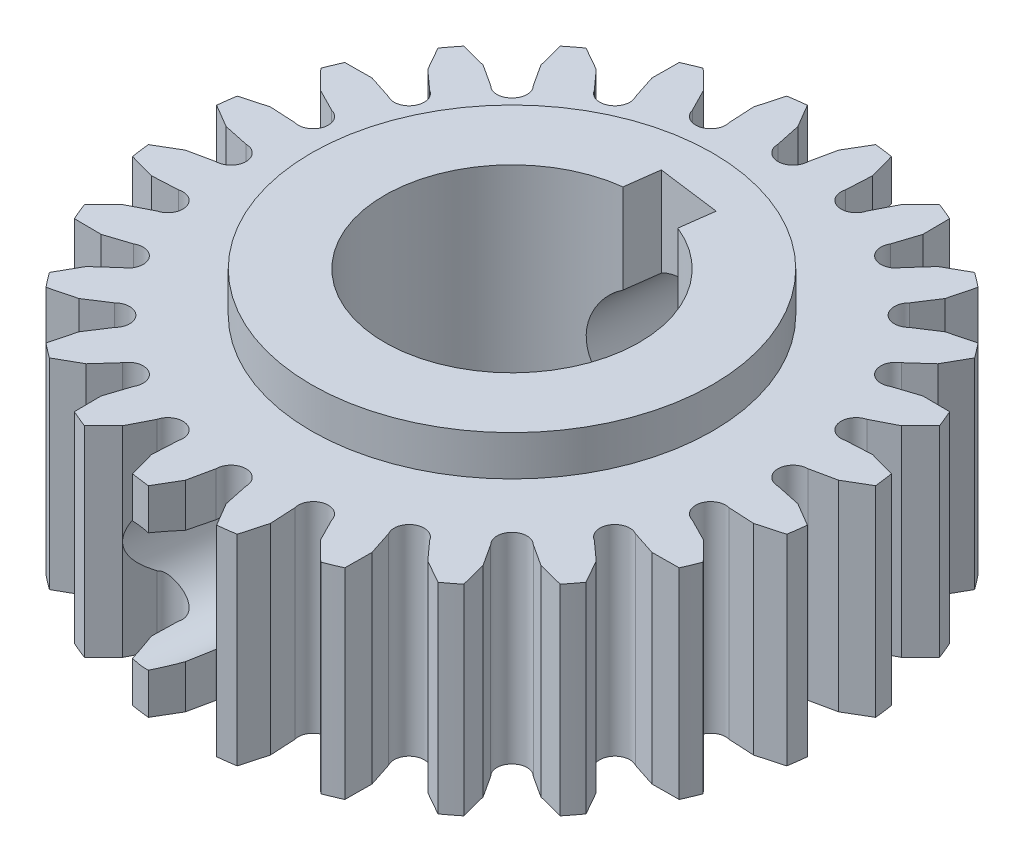
from build123d import *

# Parameters (mm, degrees)
BOSS_EXTRUDE2_DEPTH     = 5
CUT_EXTRUDE2_DEPTH      = 13.700001969
CIRPATTERN1_COUNT       = 24
SKETCH4_R               = 5
BOSS_EXTRUDE3_DEPTH     = 1
SKETCH5_R               = 3.175
CUT_EXTRUDE3_DEPTH      = 14.070770827
CUT_EXTRUDE4_DEPTH      = 14.070770827
CUT_EXTRUDE4_DEPTH_BACK = 14.070770827


with BuildPart() as part:
    # Sketch2 → Boss-Extrude2 (new body)
    with BuildSketch(Plane(origin=(0, 0, 0), x_dir=(1, 0, 0), z_dir=(0, 1, 0))):
        with BuildLine():
            ThreePointArc((-0.975804038, 8.197123366), (-5.48132113, -6.172531382), (8.255, 0))
            ThreePointArc((8.255, 0), (6.172531382, 5.48132113), (0.975804038, 8.197123366))
            add(Edge.make_bspline(
                [(0.375, 7.0025), (0.502106264, 7.67368826), (0.975804038, 8.197123366)],
                knots=[0, 0, 0, 1, 1, 1], degree=2))
            ThreePointArc((0.375, 7.0025), (0, 6.6275), (-0.375, 7.0025))
            add(Edge.make_bspline(
                [(-0.375, 7.0025), (-0.502106264, 7.67368826), (-0.975804038, 8.197123366)],
                knots=[0, 0, 0, 1, 1, 1], degree=2))
        make_face()
        with BuildLine():
            add(Edge.make_bspline(
                [(0.375, 7.0025), (0.502106264, 7.67368826), (0.975804038, 8.197123366)],
                knots=[0, 0, 0, 1, 1, 1], degree=2))
            ThreePointArc((0.975804038, 8.197123366), (0, 8.255), (-0.975804038, 8.197123366))
            add(Edge.make_bspline(
                [(-0.375, 7.0025), (-0.502106264, 7.67368826), (-0.975804038, 8.197123366)],
                knots=[0, 0, 0, 1, 1, 1], degree=2))
            ThreePointArc((-0.375, 7.0025), (0, 6.6275), (0.375, 7.0025))
        make_face()
    extrude(amount=BOSS_EXTRUDE2_DEPTH)

    # Sketch3 → Cut-Extrude2 (cut, through all)
    with BuildSketch(Plane(origin=(0, 5, 0), x_dir=(1, 0, 0), z_dir=(0, 1, 0))):
        with BuildLine():
            Line((-0.375, 7.0025), (-0.508801653, 7.631638432))
            Line((-0.508801653, 7.631638432), (-0.85, 8.211122031))
            ThreePointArc((-0.85, 8.211122031), (0, 8.255), (0.85, 8.211122031))
            Line((0.85, 8.211122031), (0.508801653, 7.631638432))
            Line((0.508801653, 7.631638432), (0.375, 7.0025))
            ThreePointArc((0.375, 7.0025), (0, 6.6275), (-0.375, 7.0025))
        make_face()
    cut_extrude2 = extrude(amount=-CUT_EXTRUDE2_DEPTH, mode=Mode.SUBTRACT)

    # CirPattern1: Cut-Extrude2 ×24 about axis
    cirpattern1_axis = Axis((0, 0, 0), (0, 1, 0))
    for i in range(1, CIRPATTERN1_COUNT):
        add(cut_extrude2.rotate(cirpattern1_axis, i * 360 / CIRPATTERN1_COUNT), mode=Mode.SUBTRACT)

    # Sketch4 → Boss-Extrude3 (add)
    with BuildSketch(Plane(origin=(0, 5, 0), x_dir=(1, 0, 0), z_dir=(0, 1, 0))):
        with Locations(Location((0, 0, 0), (0, 0, 270))):
            Circle(SKETCH4_R)
    extrude(amount=BOSS_EXTRUDE3_DEPTH)

    # Sketch5 → Cut-Extrude3 (cut, through all)
    with BuildSketch(Plane(origin=(0, 6, 0), x_dir=(1, 0, 0), z_dir=(0, 1, 0))):
        with Locations(Location((0, 0, 0), (0, 0, 270))):
            Circle(SKETCH5_R)
    extrude(amount=-CUT_EXTRUDE3_DEPTH, mode=Mode.SUBTRACT)

    # Sketch6 → Cut-Extrude4 (cut, two sides: drawn at the far end of the back side and taken through both)
    with BuildSketch(Plane(origin=(0, 6, 0), x_dir=(1, 0, 0), z_dir=(0, 1, 0)).offset(-CUT_EXTRUDE4_DEPTH_BACK)):
        Polygon((-0.410570755, 2.960645123), (-0.274396193, 3.994993614), (1.299026802, 3.787848547), (1.16285224, 2.753500056), align=None)
    extrude(amount=CUT_EXTRUDE4_DEPTH + CUT_EXTRUDE4_DEPTH_BACK, mode=Mode.SUBTRACT)

    # Sketch7 → Cut-Revolve1 (revolve, cut)
    with BuildSketch(Plane(origin=(0, 2.5, 0), x_dir=(1, 0, 0), z_dir=(0, 1, 0)), mode=Mode.PRIVATE) as cut_revolve1_sk:
        Polygon((-1.457660633, -11.072031749), (1.457660633, 11.072031749), (-0.055282808, 11.072031749), (-2.970604074, -11.072031749), align=None)
    revolve(cut_revolve1_sk.sketch.rotate(Axis((-1.457660633, 2.5, 11.072031749), (0.13052619222005166, 0, -0.9914448613738104)), 210.996252077), axis=Axis((-1.457660633, 2.5, 11.072031749), (0.13052619222005166, 0, -0.9914448613738104)), mode=Mode.SUBTRACT)


solid = part.part
